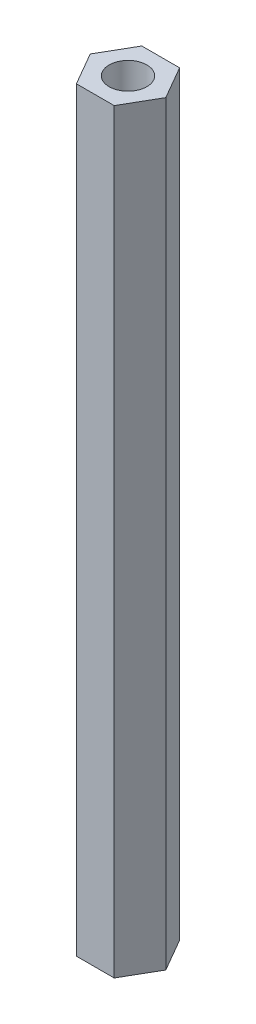
from build123d import *

# Parameters (mm, degrees)
SKETCH2_R           = 1.5
BOSS_EXTRUDE1_DEPTH = 60


with BuildPart() as part:
    # Sketch2 → Boss-Extrude1 (new body)
    with BuildSketch(Plane(origin=(0, 0, 0), x_dir=(1, 0, 0), z_dir=(0, 1, 0))):
        Polygon((3, 0), (1.5, 2.598076211), (-1.5, 2.598076211), (-3, 0), (-1.5, -2.598076211), (1.5, -2.598076211), align=None)
        with Locations(Location((0, 0, 0), (0, 0, 270))):
            Circle(SKETCH2_R, mode=Mode.SUBTRACT)
    extrude(amount=BOSS_EXTRUDE1_DEPTH)


solid = part.part
